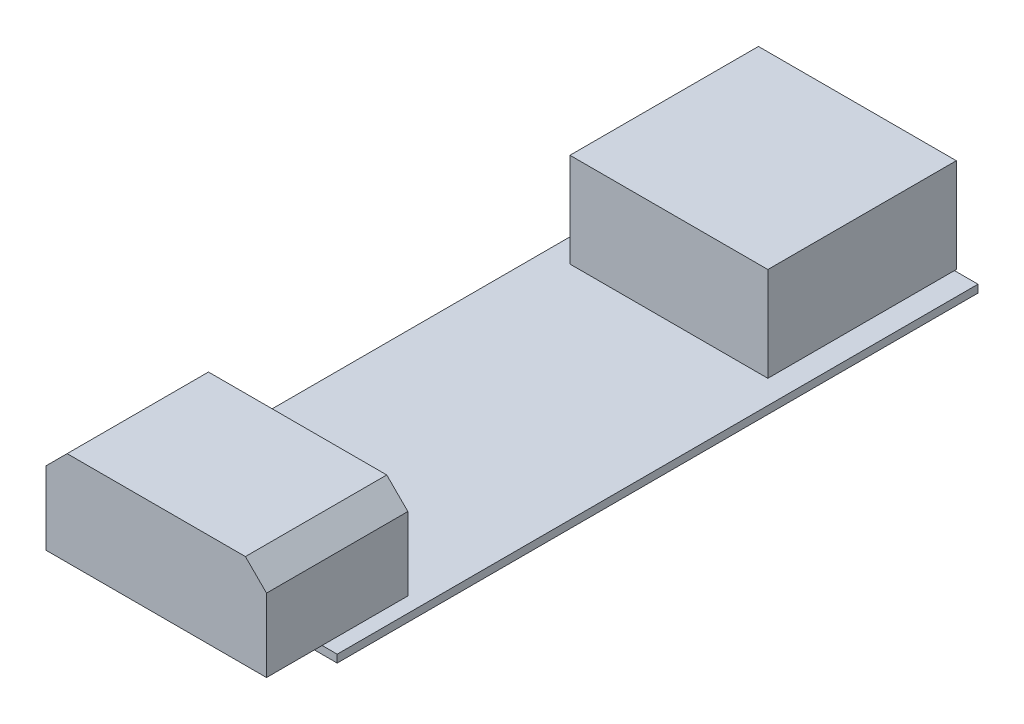
from build123d import *

# Parameters (mm, degrees)
DODANIE_WYCI_GNI_CIE1_DEPTH = 7.5
SZKIC2_W                    = 13
SZKIC2_H                    = 34
DODANIE_WYCI_GNI_CIE2_DEPTH = 0.41
SZKIC3_R                    = 0.3
DODANIE_WYCI_GNI_CIE3_DEPTH = 1.69
SZKIC4_W                    = 10.5
SZKIC4_H                    = 10
DODANIE_WYCI_GNI_CIE4_DEPTH = 5
SZKIC6_R                    = 0.4
DODANIE_WYCI_GNI_CIE5_DEPTH = 1.7


with BuildPart() as part:
    # Szkic1 → Dodanie-wyciągnięcie1 (new body)
    with BuildSketch(Plane.XY):
        Polygon((10.58, 5), (11.7, 3.88), (11.7, 0), (0, 0), (0, 3.88), (1.12, 5), align=None)
    extrude(amount=DODANIE_WYCI_GNI_CIE1_DEPTH)

    # Szkic2 → Dodanie-wyciągnięcie2 (add)
    with BuildSketch(Plane.XZ):
        with Locations((6, -12.45)):
            Rectangle(SZKIC2_W, SZKIC2_H)
    extrude(amount=DODANIE_WYCI_GNI_CIE2_DEPTH)

    # Szkic3 → Dodanie-wyciągnięcie3 (add)
    with BuildSketch(Plane.XZ.offset(0.41)):
        with Locations(Location((2.255290514, 0.3, 0), (0, 0, 270))):
            Circle(SZKIC3_R)
        with Locations(Location((4.755290514, 0.3, 0), (0, 0, 270))):
            Circle(SZKIC3_R)
        with Locations(Location((7.255290514, 0.3, 0), (0, 0, 270))):
            Circle(SZKIC3_R)
        with Locations(Location((9.755290514, 0.3, 0), (0, 0, 270))):
            Circle(SZKIC3_R)
    extrude(amount=DODANIE_WYCI_GNI_CIE3_DEPTH)

    # Szkic4 → Dodanie-wyciągnięcie4 (add)
    with BuildSketch(Plane(origin=(0, 0, 0), x_dir=(1, 0, 0), z_dir=(0, 1, 0))):
        with Locations((6, 24.55)):
            Rectangle(SZKIC4_W, SZKIC4_H)
    extrude(amount=DODANIE_WYCI_GNI_CIE4_DEPTH)

    # Szkic6 → Dodanie-wyciągnięcie5 (add)
    with BuildSketch(Plane.XZ.offset(0.41)):
        with Locations(Location((2.255290514, -26.7, 0), (0, 0, 270))):
            Circle(SZKIC6_R)
        with Locations(Location((4.755290514, -26.7, 0), (0, 0, 270))):
            Circle(SZKIC6_R)
        with Locations(Location((7.255290514, -26.7, 0), (0, 0, 270))):
            Circle(SZKIC6_R)
        with Locations(Location((9.755290514, -26.7, 0), (0, 0, 270))):
            Circle(SZKIC6_R)
        with Locations(Location((4.755290514, -21.7, 0), (0, 0, 270))):
            Circle(SZKIC6_R)
        with Locations(Location((7.255290514, -21.7, 0), (0, 0, 270))):
            Circle(SZKIC6_R)
        with Locations(Location((9.755290514, -21.7, 0), (0, 0, 270))):
            Circle(SZKIC6_R)
        with Locations(Location((2.255290514, -21.7, 0), (0, 0, 270))):
            Circle(SZKIC6_R)
    extrude(amount=DODANIE_WYCI_GNI_CIE5_DEPTH)


solid = part.part
